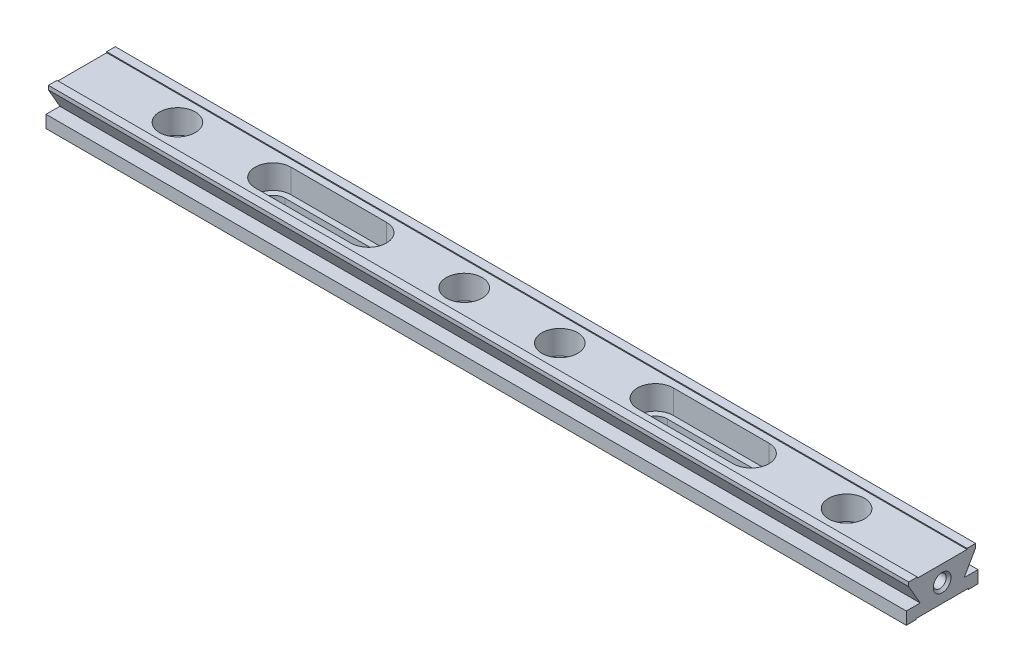
from build123d import *

# Parameters (mm, degrees)
BOSS_EXTRUDE1_DEPTH = 228.6
SKETCH5_R           = 3.175
CUT_EXTRUDE1_DEPTH  = 229.99128374
SKETCH5_4_R         = 4.7625
CUT_EXTRUDE2_DEPTH  = 6.35


with BuildPart() as part:
    # Sketch1 → Boss-Extrude1 (new body)
    with BuildSketch(Plane(origin=(0, 0, 0), x_dir=(0, 0, -1), z_dir=(1, 0, 0))):
        Polygon((9.525, -0.254), (9.525, 3.048), (5.842, 3.048), (8.89, 8.327290861), (8.89, 9.398), (6.604, 9.398), (6.604, 9.144), (0, 9.144), (0, 0), (6.985, 0), (6.985, -0.254), align=None)
    boss_extrude1 = extrude(amount=BOSS_EXTRUDE1_DEPTH)

    # Mirror1: Boss-Extrude1 across plane
    add(boss_extrude1.mirror(Plane.XY))

    # Sketch4 → Tap Drill for #8-32 Tap2 (revolve, cut)
    with BuildSketch(Plane.ZX.offset(4.826)):
        Polygon((0, 0), (0, 13.737806461), (1.7272, 12.7), (1.7272, 0.635), (2.3622, 0), align=None)
    tap_drill_for_8_32_tap2 = revolve(axis=Axis((-6.35, 4.826, 0), (1, 0, 0)), mode=Mode.SUBTRACT)

    # Mirror2: Tap Drill for #8-32 Tap2 across plane
    add(tap_drill_for_8_32_tap2.mirror(Plane.ZY.offset(-114.3)), mode=Mode.SUBTRACT)

    # Sketch5 → Cut-Extrude1 (cut, through all)
    with BuildSketch(Plane(origin=(0, 9.144, 0), x_dir=(1, 0, 0), z_dir=(0, 1, 0))):
        with Locations((25.4, 0)):
            Circle(SKETCH5_R)
        with Locations((101.6, 0)):
            Circle(SKETCH5_R)
        with Locations((127, 0)):
            Circle(SKETCH5_R)
        with Locations((203.2, 0)):
            Circle(SKETCH5_R)
        with BuildLine():
            Line((50.8, 3.175), (76.2, 3.175))
            ThreePointArc((76.2, 3.175), (79.375, 0), (76.2, -3.175))
            Line((76.2, -3.175), (50.8, -3.175))
            ThreePointArc((50.8, -3.175), (47.625, 0), (50.8, 3.175))
        make_face()
        with BuildLine():
            Line((152.4, 3.175), (177.8, 3.175))
            ThreePointArc((177.8, 3.175), (180.975, 0), (177.8, -3.175))
            Line((177.8, -3.175), (152.4, -3.175))
            ThreePointArc((152.4, -3.175), (149.225, 0), (152.4, 3.175))
        make_face()
    extrude(amount=-CUT_EXTRUDE1_DEPTH, mode=Mode.SUBTRACT)

    # Sketch5<4> → Cut-Extrude2 (cut)
    with BuildSketch(Plane(origin=(0, 9.144, 0), x_dir=(1, 0, 0), z_dir=(0, 1, 0))):
        with Locations((25.4, 0)):
            Circle(SKETCH5_4_R)
        with Locations((101.6, 0)):
            Circle(SKETCH5_4_R)
        with Locations((127, 0)):
            Circle(SKETCH5_4_R)
        with Locations((203.2, 0)):
            Circle(SKETCH5_4_R)
        with BuildLine():
            Line((50.8, 4.7625), (76.2, 4.7625))
            ThreePointArc((76.2, 4.7625), (80.9625, 0), (76.2, -4.7625))
            Line((76.2, -4.7625), (50.8, -4.7625))
            ThreePointArc((50.8, -4.7625), (46.0375, 0), (50.8, 4.7625))
        make_face()
        with BuildLine():
            Line((152.4, 4.7625), (177.8, 4.7625))
            ThreePointArc((177.8, 4.7625), (182.5625, 0), (177.8, -4.7625))
            Line((177.8, -4.7625), (152.4, -4.7625))
            ThreePointArc((152.4, -4.7625), (147.6375, 0), (152.4, 4.7625))
        make_face()
    extrude(amount=-CUT_EXTRUDE2_DEPTH, mode=Mode.SUBTRACT)


solid = part.part
